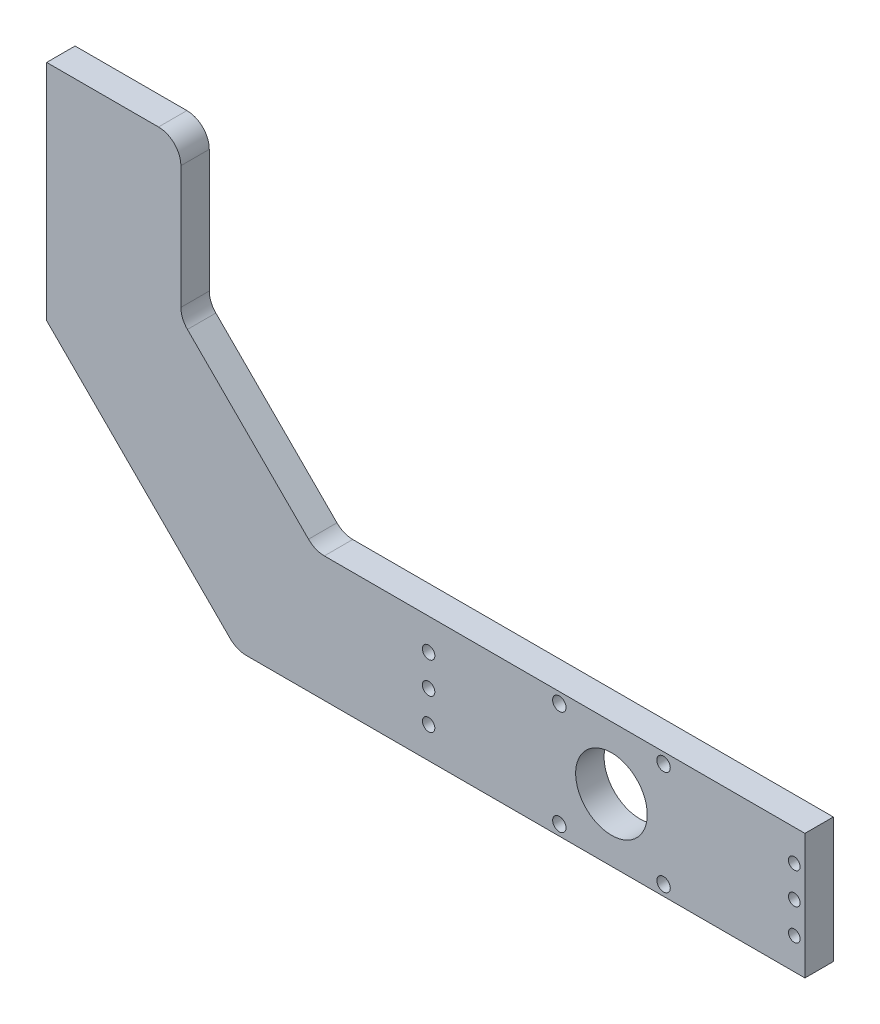
from build123d import *

# Parameters (mm, degrees)
RESSALTO_EXTRUS_O1_DEPTH   = 12.7
CIRCULO_DE_ROLAMENTO_REACH = 245.52
ESBO_O3_R                  = 16
CORTE_EXTRUS_O3_REACH      = 245.52
ESBO_O5_R                  = 3
ESBO_O6_R                  = 2.5
CORTE_EXTRUS_O4_DEPTH      = 30
CORTE_EXTRUS_O6_REACH      = 245.52
CORTE_EXTRUS_O7_REACH      = 245.52
ESBO_O10_R                 = 2.78
CORTE_EXTRUS_O8_REACH      = 245.52
ESBO_O12_R                 = 2.6
FILETE1_R                  = 10


with BuildPart() as part:
    # Esboço1 → Ressalto-extrusão1 (new body)
    with BuildSketch(Plane.XY):
        Polygon((-114.28595772, -92.023971813), (224.71404228, -92.023971813), (224.71404228, -36.023971813), (5.71404228, -36.023971813), (-54.28595772, 23.976028187), (-54.28595772, 92.976028187), (-114.28595772, 92.976028187), align=None)
    extrude(amount=RESSALTO_EXTRUS_O1_DEPTH)

    # Esboço3 → circulo de rolamento (cut, up to next)
    with BuildSketch(Plane.XY.offset(12.7), mode=Mode.PRIVATE) as circulo_de_rolamento_sk1:
        with Locations((138.21404228, -64.023971813)):
            Circle(ESBO_O3_R)
    circulo_de_rolamento_tool1 = extrude(circulo_de_rolamento_sk1.sketch, amount=-CIRCULO_DE_ROLAMENTO_REACH, mode=Mode.PRIVATE) & part.part
    add(circulo_de_rolamento_tool1.solids().sort_by_distance((138.214042, -64.023972, 12.7))[0], mode=Mode.SUBTRACT)

    # Esboço5 → Corte-extrusão3 (cut, up to next)
    with BuildSketch(Plane.XY.offset(12.7), mode=Mode.PRIVATE) as corte_extrus_o3_sk1:
        with Locations((114.91404228, -40.723971813)):
            Circle(ESBO_O5_R)
    corte_extrus_o3_tool1 = extrude(corte_extrus_o3_sk1.sketch, amount=-CORTE_EXTRUS_O3_REACH, mode=Mode.PRIVATE) & part.part
    # Esboço5 → Corte-extrusão3 (cut, up to next)
    with BuildSketch(Plane.XY.offset(12.7), mode=Mode.PRIVATE) as corte_extrus_o3_sk2:
        with Locations((161.51404228, -40.723971813)):
            Circle(ESBO_O5_R)
    corte_extrus_o3_tool2 = extrude(corte_extrus_o3_sk2.sketch, amount=-CORTE_EXTRUS_O3_REACH, mode=Mode.PRIVATE) & part.part
    # Esboço5 → Corte-extrusão3 (cut, up to next)
    with BuildSketch(Plane.XY.offset(12.7), mode=Mode.PRIVATE) as corte_extrus_o3_sk3:
        with Locations((161.51404228, -87.323971813)):
            Circle(ESBO_O5_R)
    corte_extrus_o3_tool3 = extrude(corte_extrus_o3_sk3.sketch, amount=-CORTE_EXTRUS_O3_REACH, mode=Mode.PRIVATE) & part.part
    # Esboço5 → Corte-extrusão3 (cut, up to next)
    with BuildSketch(Plane.XY.offset(12.7), mode=Mode.PRIVATE) as corte_extrus_o3_sk4:
        with Locations((114.91404228, -87.323971813)):
            Circle(ESBO_O5_R)
    corte_extrus_o3_tool4 = extrude(corte_extrus_o3_sk4.sketch, amount=-CORTE_EXTRUS_O3_REACH, mode=Mode.PRIVATE) & part.part
    add(corte_extrus_o3_tool1.solids().sort_by_distance((114.914042, -40.723972, 12.7))[0], mode=Mode.SUBTRACT)
    add(corte_extrus_o3_tool2.solids().sort_by_distance((161.514042, -40.723972, 12.7))[0], mode=Mode.SUBTRACT)
    add(corte_extrus_o3_tool3.solids().sort_by_distance((161.514042, -87.323972, 12.7))[0], mode=Mode.SUBTRACT)
    add(corte_extrus_o3_tool4.solids().sort_by_distance((114.914042, -87.323972, 12.7))[0], mode=Mode.SUBTRACT)

    # Esboço6 → Corte-extrusão4 (cut)
    with BuildSketch(Plane.ZY.offset(114.28595772)):
        with Locations(Location((4.765, 67.976028187, 0), (0, 0, 270))):
            Circle(ESBO_O6_R)
        with Locations(Location((4.765, 42.976028187, 0), (0, 0, 270))):
            Circle(ESBO_O6_R)
        with Locations(Location((4.765, 17.976028187, 0), (0, 0, 270))):
            Circle(ESBO_O6_R)
    extrude(amount=-CORTE_EXTRUS_O4_DEPTH, mode=Mode.SUBTRACT)

    # Esboço9 → Corte-extrusão6 (cut, up to next)
    with BuildSketch(Plane.XY.offset(12.7), mode=Mode.PRIVATE) as corte_extrus_o6_sk1:
        Polygon((-29.28595772, -92.023971813), (-114.28595772, -7.023971813), (-114.28595772, -92.023971813), align=None)
    corte_extrus_o6_tool1 = extrude(corte_extrus_o6_sk1.sketch, amount=-CORTE_EXTRUS_O6_REACH, mode=Mode.PRIVATE) & part.part
    add(corte_extrus_o6_tool1.solids().sort_by_distance((-85.952624, -63.690638, 12.7))[0], mode=Mode.SUBTRACT)

    # Esboço10 → Corte-extrusão7 (cut, up to next)
    with BuildSketch(Plane.XY.offset(12.7), mode=Mode.PRIVATE) as corte_extrus_o7_sk1:
        with Locations((56.47404228, -50.023971813)):
            Circle(ESBO_O10_R)
    corte_extrus_o7_tool1 = extrude(corte_extrus_o7_sk1.sketch, amount=-CORTE_EXTRUS_O7_REACH, mode=Mode.PRIVATE) & part.part
    # Esboço10 → Corte-extrusão7 (cut, up to next)
    with BuildSketch(Plane.XY.offset(12.7), mode=Mode.PRIVATE) as corte_extrus_o7_sk2:
        with Locations((56.47404228, -64.023971813)):
            Circle(ESBO_O10_R)
    corte_extrus_o7_tool2 = extrude(corte_extrus_o7_sk2.sketch, amount=-CORTE_EXTRUS_O7_REACH, mode=Mode.PRIVATE) & part.part
    # Esboço10 → Corte-extrusão7 (cut, up to next)
    with BuildSketch(Plane.XY.offset(12.7), mode=Mode.PRIVATE) as corte_extrus_o7_sk3:
        with Locations((56.47404228, -78.023971813)):
            Circle(ESBO_O10_R)
    corte_extrus_o7_tool3 = extrude(corte_extrus_o7_sk3.sketch, amount=-CORTE_EXTRUS_O7_REACH, mode=Mode.PRIVATE) & part.part
    add(corte_extrus_o7_tool1.solids().sort_by_distance((56.474042, -50.023972, 12.7))[0], mode=Mode.SUBTRACT)
    add(corte_extrus_o7_tool2.solids().sort_by_distance((56.474042, -64.023972, 12.7))[0], mode=Mode.SUBTRACT)
    add(corte_extrus_o7_tool3.solids().sort_by_distance((56.474042, -78.023972, 12.7))[0], mode=Mode.SUBTRACT)

    # Esboço12 → Corte-extrusão8 (cut, up to next)
    with BuildSketch(Plane.XY.offset(12.7), mode=Mode.PRIVATE) as corte_extrus_o8_sk1:
        with Locations((219.95404228, -50.023971813)):
            Circle(ESBO_O12_R)
    corte_extrus_o8_tool1 = extrude(corte_extrus_o8_sk1.sketch, amount=-CORTE_EXTRUS_O8_REACH, mode=Mode.PRIVATE) & part.part
    # Esboço12 → Corte-extrusão8 (cut, up to next)
    with BuildSketch(Plane.XY.offset(12.7), mode=Mode.PRIVATE) as corte_extrus_o8_sk2:
        with Locations((219.95404228, -64.023971813)):
            Circle(ESBO_O12_R)
    corte_extrus_o8_tool2 = extrude(corte_extrus_o8_sk2.sketch, amount=-CORTE_EXTRUS_O8_REACH, mode=Mode.PRIVATE) & part.part
    # Esboço12 → Corte-extrusão8 (cut, up to next)
    with BuildSketch(Plane.XY.offset(12.7), mode=Mode.PRIVATE) as corte_extrus_o8_sk3:
        with Locations((219.95404228, -78.023971813)):
            Circle(ESBO_O12_R)
    corte_extrus_o8_tool3 = extrude(corte_extrus_o8_sk3.sketch, amount=-CORTE_EXTRUS_O8_REACH, mode=Mode.PRIVATE) & part.part
    add(corte_extrus_o8_tool1.solids().sort_by_distance((219.954042, -50.023972, 12.7))[0], mode=Mode.SUBTRACT)
    add(corte_extrus_o8_tool2.solids().sort_by_distance((219.954042, -64.023972, 12.7))[0], mode=Mode.SUBTRACT)
    add(corte_extrus_o8_tool3.solids().sort_by_distance((219.954042, -78.023972, 12.7))[0], mode=Mode.SUBTRACT)

    # Filete1
    filete1_edges = [part.edges().sort_by_distance(p)[0] for p in [
        (-54.28595772, 92.976028187, 6.35),
        (-54.28595772, 23.976028187, 6.35),
        (5.71404228, -36.023971813, 6.35),
        (-29.28595772, -92.023971813, 6.35),
    ]]
    fillet(filete1_edges, radius=FILETE1_R)


solid = part.part
